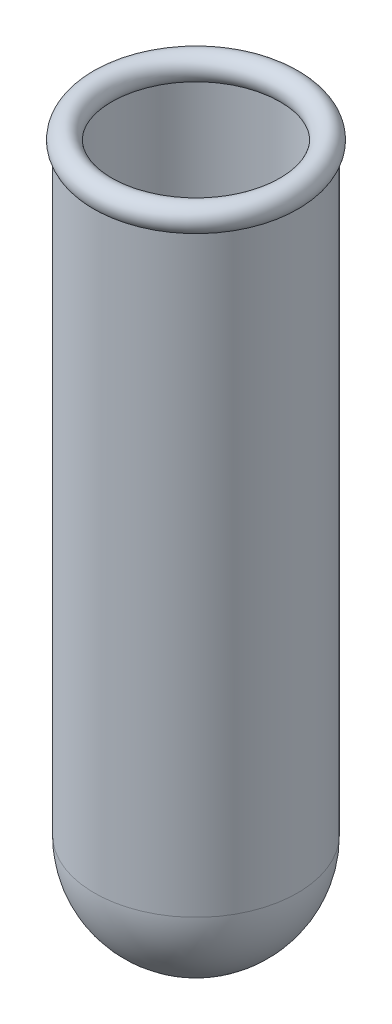
from build123d import *


with BuildPart() as part:
    # Sketch1 → Revolve1 (revolve)
    with BuildSketch(Plane.XY, mode=Mode.PRIVATE) as revolve1_sk:
        with BuildLine():
            ThreePointArc((5, -3.31662479), (5.744562647, -1.732050808), (6, 0))
            Line((6, 0), (6, 35))
            ThreePointArc((6, 35), (6.002835942, 36.115484437), (4.893341951, 36))
            ThreePointArc((4.893341951, 36), (4.754229922, 35.479474613), (5, 35))
            Line((5, 35), (5, 0))
            ThreePointArc((5, 0), (3.535533906, -3.535533906), (0, -5))
            Line((0, -5), (0, -6))
            ThreePointArc((0, -6), (2.837274331, -5.286764074), (5, -3.31662479))
        make_face()
    revolve(revolve1_sk.sketch.rotate(Axis((0, 0, 0), (0, 1, 0)), 90), axis=Axis((0, 0, 0), (0, 1, 0)))


solid = part.part
